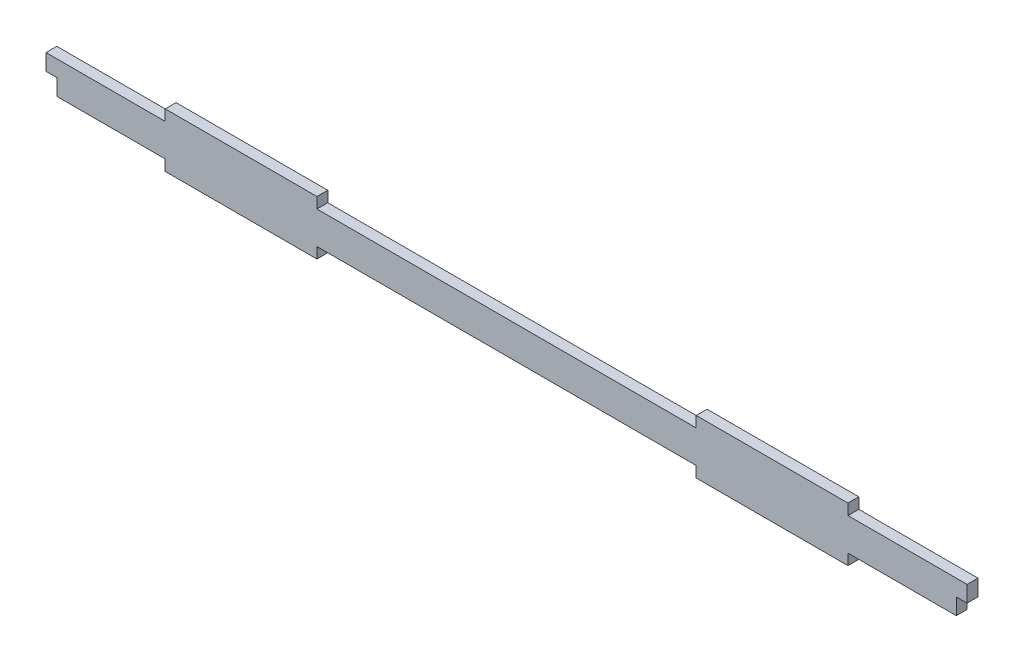
from build123d import *

# Parameters (mm, degrees)
SKETCH1_W           = 415
SKETCH1_H           = 15
BOSS_EXTRUDE1_DEPTH = 5
SKETCH2_W           = 5
SKETCH2_H           = 7.5
SKETCH2_W_2         = 70
SKETCH2_H_2         = 5
BOSS_EXTRUDE2_DEPTH = 5


with BuildPart() as part:
    # Sketch1 → Boss-Extrude1 (new body)
    with BuildSketch(Plane.XY):
        with Locations((-207.5, 7.5)):
            Rectangle(SKETCH1_W, SKETCH1_H)
    extrude(amount=BOSS_EXTRUDE1_DEPTH)

    # Sketch2 → Boss-Extrude2 (add)
    with BuildSketch(Plane.XY.offset(5)):
        with Locations((-417.5, 11.25)):
            Rectangle(SKETCH2_W, SKETCH2_H)
        with Locations((2.5, 11.25)):
            Rectangle(SKETCH2_W, SKETCH2_H)
        with Locations((-330, 17.5)):
            Rectangle(SKETCH2_W_2, SKETCH2_H_2)
        with Locations((-85, 17.5)):
            Rectangle(SKETCH2_W_2, SKETCH2_H_2)
        with Locations((-330, -2.5)):
            Rectangle(SKETCH2_W_2, SKETCH2_H_2)
        with Locations((-85, -2.5)):
            Rectangle(SKETCH2_W_2, SKETCH2_H_2)
    extrude(amount=-BOSS_EXTRUDE2_DEPTH)


solid = part.part
